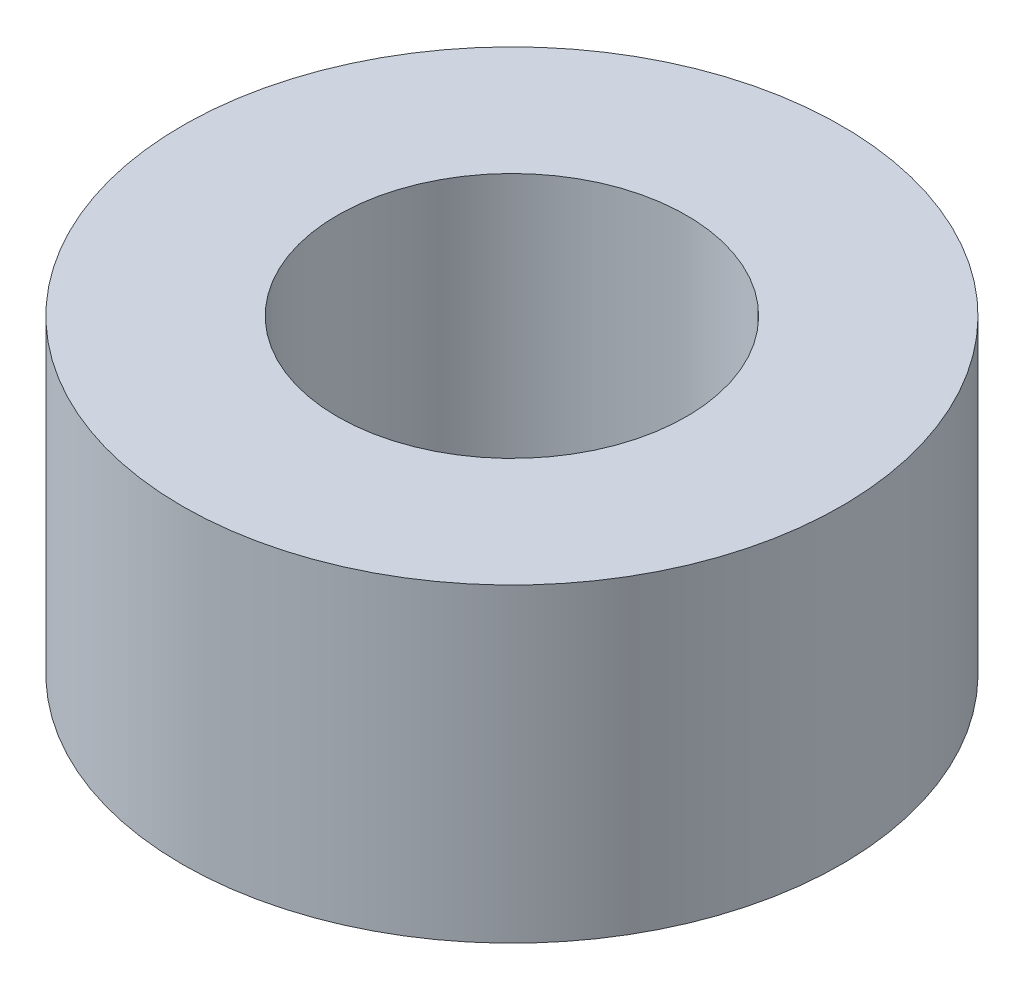
from build123d import *

# Parameters (mm, degrees)
SKETCH1_R           = 4.25
SKETCH1_R_2         = 2.25
BOSS_EXTRUDE1_DEPTH = 4


with BuildPart() as part:
    # Sketch1 → Boss-Extrude1 (new body)
    with BuildSketch(Plane(origin=(0, 0, 0), x_dir=(1, 0, 0), z_dir=(0, 1, 0))):
        with Locations(Location((0, 0, 0), (0, 0, 270))):
            Circle(SKETCH1_R)
        with Locations(Location((0, 0, 0), (0, 0, 270))):
            Circle(SKETCH1_R_2, mode=Mode.SUBTRACT)
    extrude(amount=BOSS_EXTRUDE1_DEPTH)


solid = part.part
